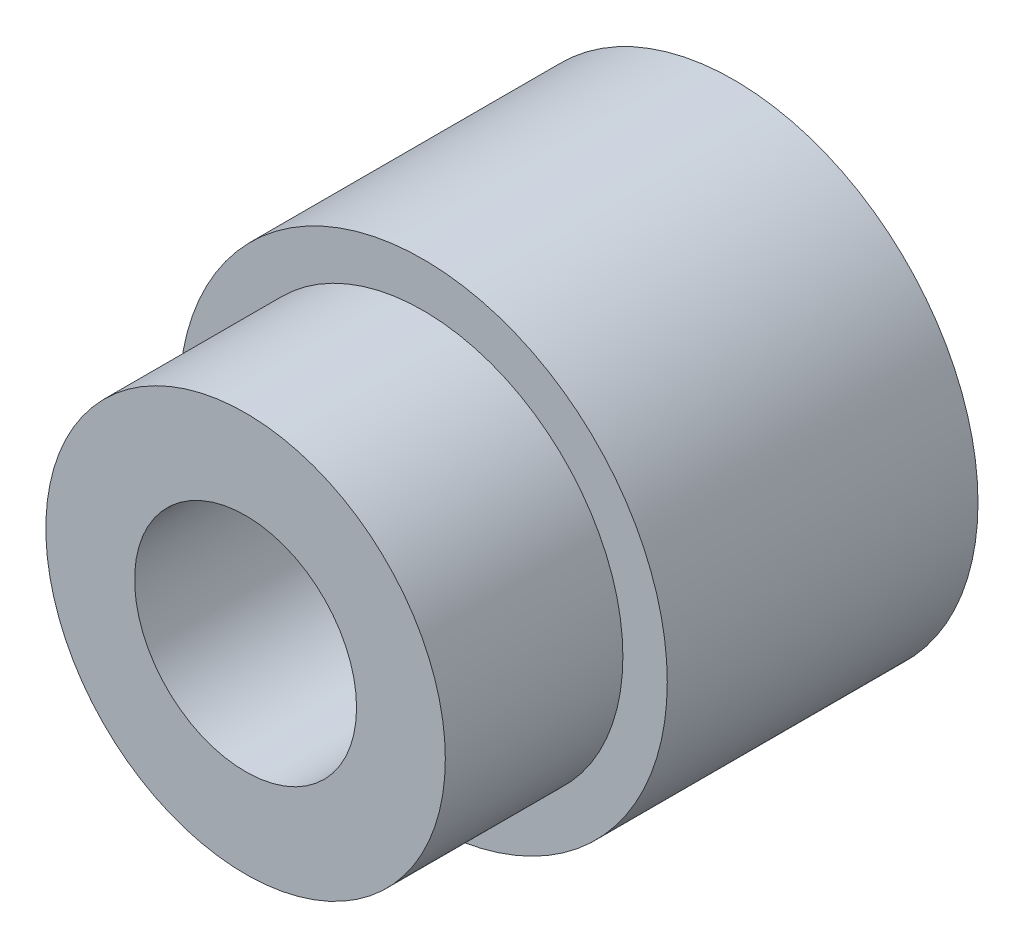
from build123d import *

# Parameters (mm, degrees)
SKETCH1_R           = 5.5
BOSS_EXTRUDE1_DEPTH = 7
SKETCH2_R           = 4.5
BOSS_EXTRUDE2_DEPTH = 4
CUT_EXTRUDE1_REACH  = 15.472
SKETCH3_R           = 2.5


with BuildPart() as part:
    # Sketch1 → Boss-Extrude1 (new body)
    with BuildSketch(Plane.XY):
        Circle(SKETCH1_R)
    extrude(amount=BOSS_EXTRUDE1_DEPTH)

    # Sketch2 → Boss-Extrude2 (add)
    with BuildSketch(Plane.XY.offset(7)):
        Circle(SKETCH2_R)
    extrude(amount=BOSS_EXTRUDE2_DEPTH)

    # Sketch3 → Cut-Extrude1 (cut, up to next)
    with BuildSketch(Plane.XY.offset(11), mode=Mode.PRIVATE) as cut_extrude1_sk1:
        Circle(SKETCH3_R)
    cut_extrude1_tool1 = extrude(cut_extrude1_sk1.sketch, amount=-CUT_EXTRUDE1_REACH, mode=Mode.PRIVATE) & part.part
    add(cut_extrude1_tool1.solids().sort_by_distance((0, 0, 11))[0], mode=Mode.SUBTRACT)


solid = part.part
